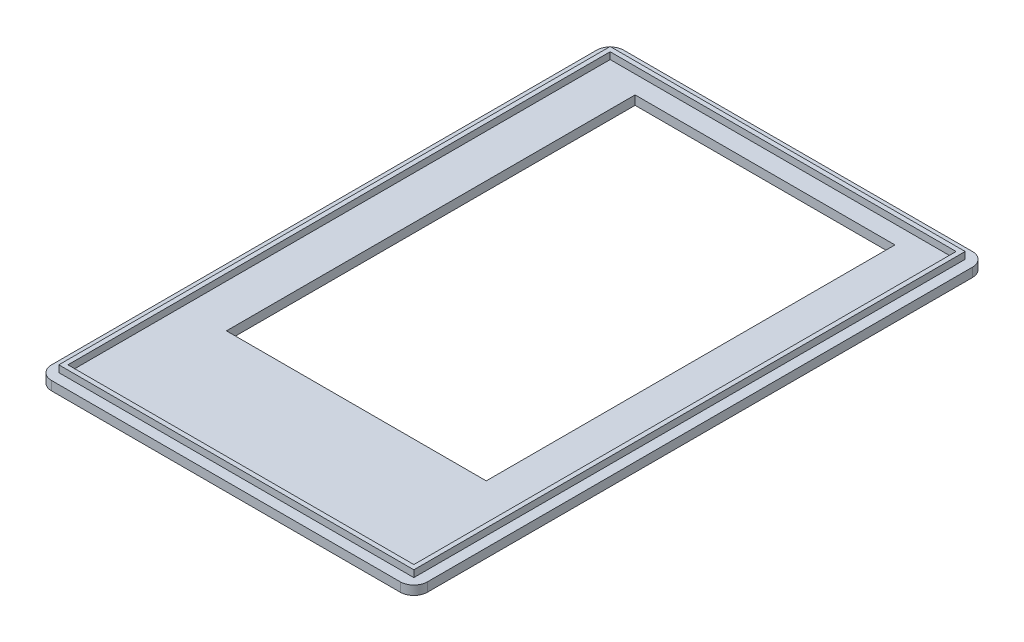
from build123d import *

# Parameters (mm, degrees)
SKETCH1_W           = 83
SKETCH1_H           = 126.35
SKETCH1_W_2         = 57.38
SKETCH1_H_2         = 90.25
BOSS_EXTRUDE1_DEPTH = 2
SKETCH2_W           = 78.4
SKETCH2_H           = 121.75
SKETCH2_W_2         = 76.4
SKETCH2_H_2         = 119.75
BOSS_EXTRUDE2_DEPTH = 1.5
FILLET1_R           = 3


with BuildPart() as part:
    # Sketch1 → Boss-Extrude1 (new body)
    with BuildSketch(Plane(origin=(0, 0, 0), x_dir=(1, 0, 0), z_dir=(0, 1, 0))):
        Rectangle(SKETCH1_W, SKETCH1_H)
        with Locations((0, 10.75)):
            Rectangle(SKETCH1_W_2, SKETCH1_H_2, mode=Mode.SUBTRACT)
    extrude(amount=BOSS_EXTRUDE1_DEPTH)

    # Sketch2 → Boss-Extrude2 (add)
    with BuildSketch(Plane(origin=(0, 2, 0), x_dir=(1, 0, 0), z_dir=(0, 1, 0))):
        Rectangle(SKETCH2_W, SKETCH2_H)
        Rectangle(SKETCH2_W_2, SKETCH2_H_2, mode=Mode.SUBTRACT)
    extrude(amount=BOSS_EXTRUDE2_DEPTH)

    # Fillet1
    fillet1_edges = [part.edges().sort_by_distance(p)[0] for p in [
        (-41.5, 1, -63.175),
        (41.5, 1, -63.175),
        (41.5, 1, 63.175),
        (-41.5, 1, 63.175),
    ]]
    fillet(fillet1_edges, radius=FILLET1_R)


solid = part.part
